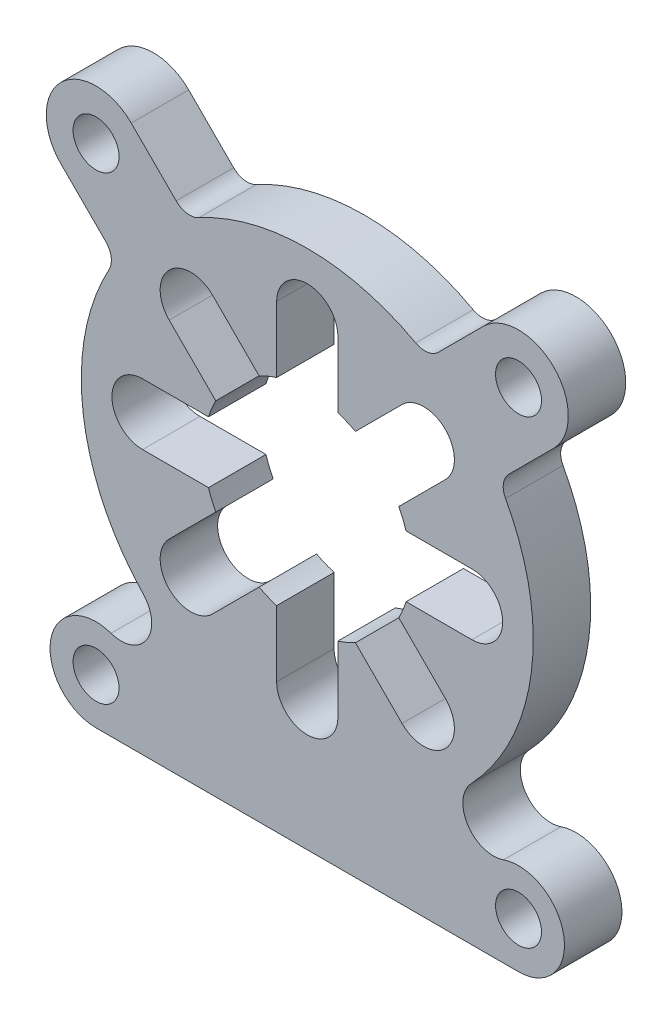
from build123d import *

# Parameters (mm, degrees)
SALIENTE_EXTRUIR1_DEPTH = 15
CROQUIS2_R              = 6
CORTAR_EXTRUIR1_DEPTH   = 104.918297485


with BuildPart() as part:
    # Croquis1 → Saliente-Extruir1 (new body)
    with BuildSketch(Plane.XY):
        with BuildLine():
            Line((-64.346717088, 45.961940777), (-52.620489657, 34.235713346))
            ThreePointArc((-52.620489657, 34.235713346), (-51.206737587, 31.410509176), (-51.768834222, 28.301727921))
            ThreePointArc((-51.768834222, 28.301727921), (-58.508070764, -7.603003058), (-42.816126208, -40.592848343))
            ThreePointArc((-42.816126208, -40.592848343), (-41.896840908, -50.430118648), (-51.234753159, -53.658178023))
            ThreePointArc((-51.234753159, -53.658178023), (-66.988640567, -63.012773757), (-55.154328933, -77))
            Line((-55.154328933, -77), (55.154328933, -77))
            ThreePointArc((55.154328933, -77), (66.988640567, -63.012773757), (51.234753159, -53.658178023))
            ThreePointArc((51.234753159, -53.658178023), (41.896840908, -50.430118648), (42.816126208, -40.592848343))
            ThreePointArc((42.816126208, -40.592848343), (58.508070764, -7.603003058), (51.768834222, 28.301727921))
            ThreePointArc((51.768834222, 28.301727921), (51.206737587, 31.410509176), (52.620489657, 34.235713346))
            Line((52.620489657, 34.235713346), (64.346717088, 45.961940777))
            ThreePointArc((64.346717088, 45.961940777), (64.346717088, 64.346717088), (45.961940777, 64.346717088))
            Line((45.961940777, 64.346717088), (34.235713346, 52.620489657))
            ThreePointArc((34.235713346, 52.620489657), (31.410509176, 51.206737587), (28.301727921, 51.768834222))
            ThreePointArc((28.301727921, 51.768834222), (0, 59), (-28.301727921, 51.768834222))
            ThreePointArc((-28.301727921, 51.768834222), (-31.410509176, 51.206737587), (-34.235713346, 52.620489657))
            Line((-34.235713346, 52.620489657), (-45.961940777, 64.346717088))
            ThreePointArc((-45.961940777, 64.346717088), (-64.346717088, 64.346717088), (-64.346717088, 45.961940777))
        make_face()
    extrude(amount=SALIENTE_EXTRUIR1_DEPTH)

    # Croquis2 → Cortar-Extruir1 (cut, through all)
    with BuildSketch(Plane.XY.offset(15)):
        with Locations((-55.154328933, 55.154328933)):
            Circle(CROQUIS2_R)
        with Locations((55.154328933, 55.154328933)):
            Circle(CROQUIS2_R)
        with Locations((-55.154328933, -65)):
            Circle(CROQUIS2_R)
        with Locations((55.154328933, -65)):
            Circle(CROQUIS2_R)
        with BuildLine():
            Line((-8, 43), (-8, 25.787593916))
            ThreePointArc((-8, 25.787593916), (-10.332452674, 24.944747378), (-12.577728279, 23.891436778))
            Line((-12.577728279, 23.891436778), (-24.748737342, 36.062445841))
            ThreePointArc((-24.748737342, 36.062445841), (-36.062445841, 36.062445841), (-36.062445841, 24.748737342))
            Line((-36.062445841, 24.748737342), (-23.891436778, 12.577728279))
            ThreePointArc((-23.891436778, 12.577728279), (-24.944747378, 10.332452674), (-25.787593916, 8))
            Line((-25.787593916, 8), (-43, 8))
            ThreePointArc((-43, 8), (-51, 0), (-43, -8))
            Line((-43, -8), (-25.787593916, -8))
            ThreePointArc((-25.787593916, -8), (-24.944747378, -10.332452674), (-23.891436778, -12.577728279))
            Line((-23.891436778, -12.577728279), (-36.062445841, -24.748737342))
            ThreePointArc((-36.062445841, -24.748737342), (-36.062445841, -36.062445841), (-24.748737342, -36.062445841))
            Line((-24.748737342, -36.062445841), (-12.577728279, -23.891436778))
            ThreePointArc((-12.577728279, -23.891436778), (-10.332452674, -24.944747378), (-8, -25.787593916))
            Line((-8, -25.787593916), (-8, -43))
            ThreePointArc((-8, -43), (0, -51), (8, -43))
            Line((8, -43), (8, -25.787593916))
            ThreePointArc((8, -25.787593916), (10.332452674, -24.944747378), (12.577728279, -23.891436778))
            Line((12.577728279, -23.891436778), (24.748737342, -36.062445841))
            ThreePointArc((24.748737342, -36.062445841), (36.062445841, -36.062445841), (36.062445841, -24.748737342))
            Line((36.062445841, -24.748737342), (23.891436778, -12.577728279))
            ThreePointArc((23.891436778, -12.577728279), (24.944747378, -10.332452674), (25.787593916, -8))
            Line((25.787593916, -8), (43, -8))
            ThreePointArc((43, -8), (51, 0), (43, 8))
            Line((43, 8), (25.787593916, 8))
            ThreePointArc((25.787593916, 8), (24.944747378, 10.332452674), (23.891436778, 12.577728279))
            Line((23.891436778, 12.577728279), (36.062445841, 24.748737342))
            ThreePointArc((36.062445841, 24.748737342), (36.062445841, 36.062445841), (24.748737342, 36.062445841))
            Line((24.748737342, 36.062445841), (12.577728279, 23.891436778))
            ThreePointArc((12.577728279, 23.891436778), (10.332452674, 24.944747378), (8, 25.787593916))
            Line((8, 25.787593916), (8, 43))
            ThreePointArc((8, 43), (0, 51), (-8, 43))
        make_face()
    extrude(amount=-CORTAR_EXTRUIR1_DEPTH, mode=Mode.SUBTRACT)


solid = part.part
